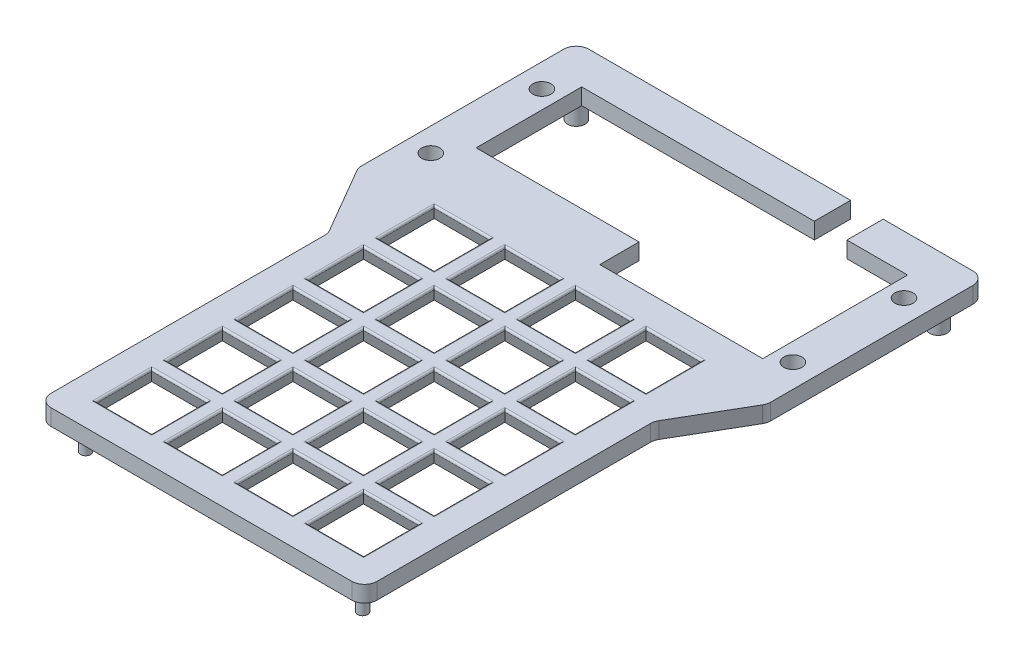
from build123d import *

# Parameters (mm, degrees)
BOSS_EXTRUDE1_DEPTH           = 4.5
SKETCH2_R                     = 1.4
SKETCH2_R_2                   = 2.4
BOSS_EXTRUDE2_DEPTH           = 7.5
SKETCH3_W                     = 45
SKETCH3_H                     = 10.839891038
SKETCH3_W_2                   = 9
SKETCH3_H_2                   = 10
SKETCH3_R                     = 2.5
CUT_EXTRUDE1_DEPTH            = 5
SKETCH4_W                     = 15
SKETCH4_H                     = 15
CUT_EXTRUDE2_DEPTH            = 4.5
CUT_EXTRUDE2_DRAFT            = -20
CUT_EXTRUDE2_PROFILE_2_DEPTH  = 4.5
CUT_EXTRUDE2_PROFILE_2_DRAFT  = -20
CUT_EXTRUDE2_PROFILE_3_DEPTH  = 4.5
CUT_EXTRUDE2_PROFILE_3_DRAFT  = -20
CUT_EXTRUDE2_PROFILE_4_DEPTH  = 4.5
CUT_EXTRUDE2_PROFILE_4_DRAFT  = -20
CUT_EXTRUDE2_PROFILE_5_DEPTH  = 4.5
CUT_EXTRUDE2_PROFILE_5_DRAFT  = -20
CUT_EXTRUDE2_PROFILE_6_DEPTH  = 4.5
CUT_EXTRUDE2_PROFILE_6_DRAFT  = -20
CUT_EXTRUDE2_PROFILE_7_DEPTH  = 4.5
CUT_EXTRUDE2_PROFILE_7_DRAFT  = -20
CUT_EXTRUDE2_PROFILE_8_DEPTH  = 4.5
CUT_EXTRUDE2_PROFILE_8_DRAFT  = -20
CUT_EXTRUDE2_PROFILE_9_DEPTH  = 4.5
CUT_EXTRUDE2_PROFILE_9_DRAFT  = -20
CUT_EXTRUDE2_PROFILE_10_DEPTH = 4.5
CUT_EXTRUDE2_PROFILE_10_DRAFT = -20
CUT_EXTRUDE2_PROFILE_11_DEPTH = 4.5
CUT_EXTRUDE2_PROFILE_11_DRAFT = -20
CUT_EXTRUDE2_PROFILE_12_DEPTH = 4.5
CUT_EXTRUDE2_PROFILE_12_DRAFT = -20
CUT_EXTRUDE2_PROFILE_13_DEPTH = 4.5
CUT_EXTRUDE2_PROFILE_13_DRAFT = -20
CUT_EXTRUDE2_PROFILE_14_DEPTH = 4.5
CUT_EXTRUDE2_PROFILE_14_DRAFT = -20
CUT_EXTRUDE2_PROFILE_15_DEPTH = 4.5
CUT_EXTRUDE2_PROFILE_15_DRAFT = -20
CUT_EXTRUDE2_PROFILE_16_DEPTH = 4.5
CUT_EXTRUDE2_PROFILE_16_DRAFT = -20
CUT_EXTRUDE2_PROFILE_17_DEPTH = 4.5
CUT_EXTRUDE2_PROFILE_17_DRAFT = -20
CUT_EXTRUDE2_PROFILE_18_DEPTH = 4.5
CUT_EXTRUDE2_PROFILE_18_DRAFT = -20
CUT_EXTRUDE2_PROFILE_19_DEPTH = 4.5
CUT_EXTRUDE2_PROFILE_19_DRAFT = -20
CUT_EXTRUDE2_PROFILE_20_DEPTH = 4.5
CUT_EXTRUDE2_PROFILE_20_DRAFT = -20
FILLET1_R                     = 3.5
FILLET3_R                     = 0.5


with BuildPart() as part:
    # Sketch1 → Boss-Extrude1 (new body)
    with BuildSketch(Plane(origin=(0, 0, 0), x_dir=(1, 0, 0), z_dir=(0, 1, 0))):
        Polygon((-57.597316241, 51.805869074), (-57.597316241, -8.444130926), (-46.097316241, -28.194130926), (-46.097316241, -108.194130926), (43.902683759, -108.194130926), (43.902683759, -28.194130926), (55.402683759, -8.444130926), (55.402683759, 51.805869074), align=None)
    extrude(amount=BOSS_EXTRUDE1_DEPTH)

    # Sketch2 → Boss-Extrude2 (add)
    with BuildSketch(Plane.XZ):
        with Locations(Location((-39.347316241, 101.944130926, 0), (0, 0, 90))):
            Circle(SKETCH2_R)
        with Locations(Location((37.152683759, 101.944130926, 0), (0, 0, 90))):
            Circle(SKETCH2_R)
        with Locations(Location((-51.097316241, -45.305869074, 0), (0, 0, 90))):
            Circle(SKETCH2_R_2)
        with Locations(Location((48.902683759, -45.305869074, 0), (0, 0, 90))):
            Circle(SKETCH2_R_2)
        with Locations(Location((-31.847316241, -5.130869074, 0), (0, 0, 90))):
            Circle(SKETCH2_R_2)
        with Locations(Location((-21.847316241, -5.130869074, 0), (0, 0, 90))):
            Circle(SKETCH2_R_2)
    extrude(amount=BOSS_EXTRUDE2_DEPTH)

    # Sketch3 → Cut-Extrude1 (cut)
    with BuildSketch(Plane.XZ):
        Polygon((-46.097316241, -41.805869074), (18.152683759, -41.805869074), (27.152683759, -41.805869074), (43.902683759, -41.805869074), (43.902683759, -12.645760112), (-1.097316241, -12.645760112), (-46.097316241, -12.645760112), align=None)
        with Locations((21.402683759, -7.225814593)):
            Rectangle(SKETCH3_W, SKETCH3_H)
        with Locations((22.652683759, -46.805869074)):
            Rectangle(SKETCH3_W_2, SKETCH3_H_2)
        with Locations(Location((48.902683759, -35.805869074, 0), (0, 0, 270))):
            Circle(SKETCH3_R)
        with Locations(Location((-51.097316241, -35.805869074, 0), (0, 0, 270))):
            Circle(SKETCH3_R)
        with Locations(Location((-51.097316241, -5.130869074, 0), (0, 0, 270))):
            Circle(SKETCH3_R)
        with Locations(Location((48.902683759, -5.130869074, 0), (0, 0, 270))):
            Circle(SKETCH3_R)
    extrude(amount=-CUT_EXTRUDE1_DEPTH, mode=Mode.SUBTRACT)


with BuildPart() as cut_extrude2_tool:
    # Sketch4 → Cut-Extrude2 (with draft: the straight prism first)
    with BuildSketch(Plane.XZ.offset(-4.5)):
        with Locations((-30.347316241, 92.694130926)):
            Rectangle(SKETCH4_W, SKETCH4_H)
    extrude(amount=CUT_EXTRUDE2_DEPTH)
    # Cut-Extrude2: the draft: its side faces are tilted about the plane it starts from
    cut_extrude2_sides = [cut_extrude2_tool.faces().sort_by_distance(p)[0] for p in [
        (-37.847316241, 2.25, 92.694130926),
        (-30.347316241, 2.25, 85.194130926),
        (-22.847316241, 2.25, 92.694130926),
        (-30.347316241, 2.25, 100.194130926),
    ]]
    draft(cut_extrude2_sides, Plane.XZ.offset(-4.5), CUT_EXTRUDE2_DRAFT)


with BuildPart() as part_1:
    add(part.part)

    # Cut-Extrude2: cut by cut_extrude2_tool
    add(cut_extrude2_tool.part, mode=Mode.SUBTRACT)


with BuildPart() as cut_extrude2_profile_2_tool:
    # Sketch4 → Cut-Extrude2 profile 2 (with draft: the straight prism first)
    with BuildSketch(Plane.XZ.offset(-4.5)):
        with Locations((-10.847316241, 92.694130926)):
            Rectangle(SKETCH4_W, SKETCH4_H)
    extrude(amount=CUT_EXTRUDE2_PROFILE_2_DEPTH)
    # Cut-Extrude2 profile 2: the draft: its side faces are tilted about the plane it starts from
    cut_extrude2_profile_2_sides = [cut_extrude2_profile_2_tool.faces().sort_by_distance(p)[0] for p in [
        (-10.847316241, 2.25, 85.194130926),
        (-3.347316241, 2.25, 92.694130926),
        (-10.847316241, 2.25, 100.194130926),
        (-18.347316241, 2.25, 92.694130926),
    ]]
    draft(cut_extrude2_profile_2_sides, Plane.XZ.offset(-4.5), CUT_EXTRUDE2_PROFILE_2_DRAFT)


with BuildPart() as part_2:
    add(part_1.part)

    # Cut-Extrude2 profile 2: cut by cut_extrude2_profile_2_tool
    add(cut_extrude2_profile_2_tool.part, mode=Mode.SUBTRACT)


with BuildPart() as cut_extrude2_profile_3_tool:
    # Sketch4 → Cut-Extrude2 profile 3 (with draft: the straight prism first)
    with BuildSketch(Plane.XZ.offset(-4.5)):
        with Locations((8.652683759, 92.694130926)):
            Rectangle(SKETCH4_W, SKETCH4_H)
    extrude(amount=CUT_EXTRUDE2_PROFILE_3_DEPTH)
    # Cut-Extrude2 profile 3: the draft: its side faces are tilted about the plane it starts from
    cut_extrude2_profile_3_sides = [cut_extrude2_profile_3_tool.faces().sort_by_distance(p)[0] for p in [
        (1.152683759, 2.25, 92.694130926),
        (8.652683759, 2.25, 85.194130926),
        (16.152683759, 2.25, 92.694130926),
        (8.652683759, 2.25, 100.194130926),
    ]]
    draft(cut_extrude2_profile_3_sides, Plane.XZ.offset(-4.5), CUT_EXTRUDE2_PROFILE_3_DRAFT)


with BuildPart() as part_3:
    add(part_2.part)

    # Cut-Extrude2 profile 3: cut by cut_extrude2_profile_3_tool
    add(cut_extrude2_profile_3_tool.part, mode=Mode.SUBTRACT)


with BuildPart() as cut_extrude2_profile_4_tool:
    # Sketch4 → Cut-Extrude2 profile 4 (with draft: the straight prism first)
    with BuildSketch(Plane.XZ.offset(-4.5)):
        with Locations((28.152683759, 92.694130926)):
            Rectangle(SKETCH4_W, SKETCH4_H)
    extrude(amount=CUT_EXTRUDE2_PROFILE_4_DEPTH)
    # Cut-Extrude2 profile 4: the draft: its side faces are tilted about the plane it starts from
    cut_extrude2_profile_4_sides = [cut_extrude2_profile_4_tool.faces().sort_by_distance(p)[0] for p in [
        (20.652683759, 2.25, 92.694130926),
        (28.152683759, 2.25, 85.194130926),
        (35.652683759, 2.25, 92.694130926),
        (28.152683759, 2.25, 100.194130926),
    ]]
    draft(cut_extrude2_profile_4_sides, Plane.XZ.offset(-4.5), CUT_EXTRUDE2_PROFILE_4_DRAFT)


with BuildPart() as part_4:
    add(part_3.part)

    # Cut-Extrude2 profile 4: cut by cut_extrude2_profile_4_tool
    add(cut_extrude2_profile_4_tool.part, mode=Mode.SUBTRACT)


with BuildPart() as cut_extrude2_profile_5_tool:
    # Sketch4 → Cut-Extrude2 profile 5 (with draft: the straight prism first)
    with BuildSketch(Plane.XZ.offset(-4.5)):
        with Locations((-10.847316241, 34.194130926)):
            Rectangle(SKETCH4_W, SKETCH4_H)
    extrude(amount=CUT_EXTRUDE2_PROFILE_5_DEPTH)
    # Cut-Extrude2 profile 5: the draft: its side faces are tilted about the plane it starts from
    cut_extrude2_profile_5_sides = [cut_extrude2_profile_5_tool.faces().sort_by_distance(p)[0] for p in [
        (-18.347316241, 2.25, 34.194130926),
        (-10.847316241, 2.25, 26.694130926),
        (-3.347316241, 2.25, 34.194130926),
        (-10.847316241, 2.25, 41.694130926),
    ]]
    draft(cut_extrude2_profile_5_sides, Plane.XZ.offset(-4.5), CUT_EXTRUDE2_PROFILE_5_DRAFT)


with BuildPart() as part_5:
    add(part_4.part)

    # Cut-Extrude2 profile 5: cut by cut_extrude2_profile_5_tool
    add(cut_extrude2_profile_5_tool.part, mode=Mode.SUBTRACT)


with BuildPart() as cut_extrude2_profile_6_tool:
    # Sketch4 → Cut-Extrude2 profile 6 (with draft: the straight prism first)
    with BuildSketch(Plane.XZ.offset(-4.5)):
        with Locations((-30.347316241, 73.194130926)):
            Rectangle(SKETCH4_W, SKETCH4_H)
    extrude(amount=CUT_EXTRUDE2_PROFILE_6_DEPTH)
    # Cut-Extrude2 profile 6: the draft: its side faces are tilted about the plane it starts from
    cut_extrude2_profile_6_sides = [cut_extrude2_profile_6_tool.faces().sort_by_distance(p)[0] for p in [
        (-37.847316241, 2.25, 73.194130926),
        (-30.347316241, 2.25, 65.694130926),
        (-22.847316241, 2.25, 73.194130926),
        (-30.347316241, 2.25, 80.694130926),
    ]]
    draft(cut_extrude2_profile_6_sides, Plane.XZ.offset(-4.5), CUT_EXTRUDE2_PROFILE_6_DRAFT)


with BuildPart() as part_6:
    add(part_5.part)

    # Cut-Extrude2 profile 6: cut by cut_extrude2_profile_6_tool
    add(cut_extrude2_profile_6_tool.part, mode=Mode.SUBTRACT)


with BuildPart() as cut_extrude2_profile_7_tool:
    # Sketch4 → Cut-Extrude2 profile 7 (with draft: the straight prism first)
    with BuildSketch(Plane.XZ.offset(-4.5)):
        with Locations((-10.847316241, 73.194130926)):
            Rectangle(SKETCH4_W, SKETCH4_H)
    extrude(amount=CUT_EXTRUDE2_PROFILE_7_DEPTH)
    # Cut-Extrude2 profile 7: the draft: its side faces are tilted about the plane it starts from
    cut_extrude2_profile_7_sides = [cut_extrude2_profile_7_tool.faces().sort_by_distance(p)[0] for p in [
        (-18.347316241, 2.25, 73.194130926),
        (-10.847316241, 2.25, 65.694130926),
        (-3.347316241, 2.25, 73.194130926),
        (-10.847316241, 2.25, 80.694130926),
    ]]
    draft(cut_extrude2_profile_7_sides, Plane.XZ.offset(-4.5), CUT_EXTRUDE2_PROFILE_7_DRAFT)


with BuildPart() as part_7:
    add(part_6.part)

    # Cut-Extrude2 profile 7: cut by cut_extrude2_profile_7_tool
    add(cut_extrude2_profile_7_tool.part, mode=Mode.SUBTRACT)


with BuildPart() as cut_extrude2_profile_8_tool:
    # Sketch4 → Cut-Extrude2 profile 8 (with draft: the straight prism first)
    with BuildSketch(Plane.XZ.offset(-4.5)):
        with Locations((8.652683759, 73.194130926)):
            Rectangle(SKETCH4_W, SKETCH4_H)
    extrude(amount=CUT_EXTRUDE2_PROFILE_8_DEPTH)
    # Cut-Extrude2 profile 8: the draft: its side faces are tilted about the plane it starts from
    cut_extrude2_profile_8_sides = [cut_extrude2_profile_8_tool.faces().sort_by_distance(p)[0] for p in [
        (1.152683759, 2.25, 73.194130926),
        (8.652683759, 2.25, 65.694130926),
        (16.152683759, 2.25, 73.194130926),
        (8.652683759, 2.25, 80.694130926),
    ]]
    draft(cut_extrude2_profile_8_sides, Plane.XZ.offset(-4.5), CUT_EXTRUDE2_PROFILE_8_DRAFT)


with BuildPart() as part_8:
    add(part_7.part)

    # Cut-Extrude2 profile 8: cut by cut_extrude2_profile_8_tool
    add(cut_extrude2_profile_8_tool.part, mode=Mode.SUBTRACT)


with BuildPart() as cut_extrude2_profile_9_tool:
    # Sketch4 → Cut-Extrude2 profile 9 (with draft: the straight prism first)
    with BuildSketch(Plane.XZ.offset(-4.5)):
        with Locations((28.152683759, 73.194130926)):
            Rectangle(SKETCH4_W, SKETCH4_H)
    extrude(amount=CUT_EXTRUDE2_PROFILE_9_DEPTH)
    # Cut-Extrude2 profile 9: the draft: its side faces are tilted about the plane it starts from
    cut_extrude2_profile_9_sides = [cut_extrude2_profile_9_tool.faces().sort_by_distance(p)[0] for p in [
        (20.652683759, 2.25, 73.194130926),
        (28.152683759, 2.25, 65.694130926),
        (35.652683759, 2.25, 73.194130926),
        (28.152683759, 2.25, 80.694130926),
    ]]
    draft(cut_extrude2_profile_9_sides, Plane.XZ.offset(-4.5), CUT_EXTRUDE2_PROFILE_9_DRAFT)


with BuildPart() as part_9:
    add(part_8.part)

    # Cut-Extrude2 profile 9: cut by cut_extrude2_profile_9_tool
    add(cut_extrude2_profile_9_tool.part, mode=Mode.SUBTRACT)


with BuildPart() as cut_extrude2_profile_10_tool:
    # Sketch4 → Cut-Extrude2 profile 10 (with draft: the straight prism first)
    with BuildSketch(Plane.XZ.offset(-4.5)):
        with Locations((-30.347316241, 53.694130926)):
            Rectangle(SKETCH4_W, SKETCH4_H)
    extrude(amount=CUT_EXTRUDE2_PROFILE_10_DEPTH)
    # Cut-Extrude2 profile 10: the draft: its side faces are tilted about the plane it starts from
    cut_extrude2_profile_10_sides = [cut_extrude2_profile_10_tool.faces().sort_by_distance(p)[0] for p in [
        (-37.847316241, 2.25, 53.694130926),
        (-30.347316241, 2.25, 46.194130926),
        (-22.847316241, 2.25, 53.694130926),
        (-30.347316241, 2.25, 61.194130926),
    ]]
    draft(cut_extrude2_profile_10_sides, Plane.XZ.offset(-4.5), CUT_EXTRUDE2_PROFILE_10_DRAFT)


with BuildPart() as part_10:
    add(part_9.part)

    # Cut-Extrude2 profile 10: cut by cut_extrude2_profile_10_tool
    add(cut_extrude2_profile_10_tool.part, mode=Mode.SUBTRACT)


with BuildPart() as cut_extrude2_profile_11_tool:
    # Sketch4 → Cut-Extrude2 profile 11 (with draft: the straight prism first)
    with BuildSketch(Plane.XZ.offset(-4.5)):
        with Locations((-10.847316241, 53.694130926)):
            Rectangle(SKETCH4_W, SKETCH4_H)
    extrude(amount=CUT_EXTRUDE2_PROFILE_11_DEPTH)
    # Cut-Extrude2 profile 11: the draft: its side faces are tilted about the plane it starts from
    cut_extrude2_profile_11_sides = [cut_extrude2_profile_11_tool.faces().sort_by_distance(p)[0] for p in [
        (-18.347316241, 2.25, 53.694130926),
        (-10.847316241, 2.25, 46.194130926),
        (-3.347316241, 2.25, 53.694130926),
        (-10.847316241, 2.25, 61.194130926),
    ]]
    draft(cut_extrude2_profile_11_sides, Plane.XZ.offset(-4.5), CUT_EXTRUDE2_PROFILE_11_DRAFT)


with BuildPart() as part_11:
    add(part_10.part)

    # Cut-Extrude2 profile 11: cut by cut_extrude2_profile_11_tool
    add(cut_extrude2_profile_11_tool.part, mode=Mode.SUBTRACT)


with BuildPart() as cut_extrude2_profile_12_tool:
    # Sketch4 → Cut-Extrude2 profile 12 (with draft: the straight prism first)
    with BuildSketch(Plane.XZ.offset(-4.5)):
        with Locations((8.652683759, 53.694130926)):
            Rectangle(SKETCH4_W, SKETCH4_H)
    extrude(amount=CUT_EXTRUDE2_PROFILE_12_DEPTH)
    # Cut-Extrude2 profile 12: the draft: its side faces are tilted about the plane it starts from
    cut_extrude2_profile_12_sides = [cut_extrude2_profile_12_tool.faces().sort_by_distance(p)[0] for p in [
        (1.152683759, 2.25, 53.694130926),
        (8.652683759, 2.25, 46.194130926),
        (16.152683759, 2.25, 53.694130926),
        (8.652683759, 2.25, 61.194130926),
    ]]
    draft(cut_extrude2_profile_12_sides, Plane.XZ.offset(-4.5), CUT_EXTRUDE2_PROFILE_12_DRAFT)


with BuildPart() as part_12:
    add(part_11.part)

    # Cut-Extrude2 profile 12: cut by cut_extrude2_profile_12_tool
    add(cut_extrude2_profile_12_tool.part, mode=Mode.SUBTRACT)


with BuildPart() as cut_extrude2_profile_13_tool:
    # Sketch4 → Cut-Extrude2 profile 13 (with draft: the straight prism first)
    with BuildSketch(Plane.XZ.offset(-4.5)):
        with Locations((28.152683759, 53.694130926)):
            Rectangle(SKETCH4_W, SKETCH4_H)
    extrude(amount=CUT_EXTRUDE2_PROFILE_13_DEPTH)
    # Cut-Extrude2 profile 13: the draft: its side faces are tilted about the plane it starts from
    cut_extrude2_profile_13_sides = [cut_extrude2_profile_13_tool.faces().sort_by_distance(p)[0] for p in [
        (20.652683759, 2.25, 53.694130926),
        (28.152683759, 2.25, 46.194130926),
        (35.652683759, 2.25, 53.694130926),
        (28.152683759, 2.25, 61.194130926),
    ]]
    draft(cut_extrude2_profile_13_sides, Plane.XZ.offset(-4.5), CUT_EXTRUDE2_PROFILE_13_DRAFT)


with BuildPart() as part_13:
    add(part_12.part)

    # Cut-Extrude2 profile 13: cut by cut_extrude2_profile_13_tool
    add(cut_extrude2_profile_13_tool.part, mode=Mode.SUBTRACT)


with BuildPart() as cut_extrude2_profile_14_tool:
    # Sketch4 → Cut-Extrude2 profile 14 (with draft: the straight prism first)
    with BuildSketch(Plane.XZ.offset(-4.5)):
        with Locations((-30.347316241, 34.194130926)):
            Rectangle(SKETCH4_W, SKETCH4_H)
    extrude(amount=CUT_EXTRUDE2_PROFILE_14_DEPTH)
    # Cut-Extrude2 profile 14: the draft: its side faces are tilted about the plane it starts from
    cut_extrude2_profile_14_sides = [cut_extrude2_profile_14_tool.faces().sort_by_distance(p)[0] for p in [
        (-37.847316241, 2.25, 34.194130926),
        (-30.347316241, 2.25, 26.694130926),
        (-22.847316241, 2.25, 34.194130926),
        (-30.347316241, 2.25, 41.694130926),
    ]]
    draft(cut_extrude2_profile_14_sides, Plane.XZ.offset(-4.5), CUT_EXTRUDE2_PROFILE_14_DRAFT)


with BuildPart() as part_14:
    add(part_13.part)

    # Cut-Extrude2 profile 14: cut by cut_extrude2_profile_14_tool
    add(cut_extrude2_profile_14_tool.part, mode=Mode.SUBTRACT)


with BuildPart() as cut_extrude2_profile_15_tool:
    # Sketch4 → Cut-Extrude2 profile 15 (with draft: the straight prism first)
    with BuildSketch(Plane.XZ.offset(-4.5)):
        with Locations((8.652683759, 34.194130926)):
            Rectangle(SKETCH4_W, SKETCH4_H)
    extrude(amount=CUT_EXTRUDE2_PROFILE_15_DEPTH)
    # Cut-Extrude2 profile 15: the draft: its side faces are tilted about the plane it starts from
    cut_extrude2_profile_15_sides = [cut_extrude2_profile_15_tool.faces().sort_by_distance(p)[0] for p in [
        (1.152683759, 2.25, 34.194130926),
        (8.652683759, 2.25, 26.694130926),
        (16.152683759, 2.25, 34.194130926),
        (8.652683759, 2.25, 41.694130926),
    ]]
    draft(cut_extrude2_profile_15_sides, Plane.XZ.offset(-4.5), CUT_EXTRUDE2_PROFILE_15_DRAFT)


with BuildPart() as part_15:
    add(part_14.part)

    # Cut-Extrude2 profile 15: cut by cut_extrude2_profile_15_tool
    add(cut_extrude2_profile_15_tool.part, mode=Mode.SUBTRACT)


with BuildPart() as cut_extrude2_profile_16_tool:
    # Sketch4 → Cut-Extrude2 profile 16 (with draft: the straight prism first)
    with BuildSketch(Plane.XZ.offset(-4.5)):
        with Locations((28.152683759, 34.194130926)):
            Rectangle(SKETCH4_W, SKETCH4_H)
    extrude(amount=CUT_EXTRUDE2_PROFILE_16_DEPTH)
    # Cut-Extrude2 profile 16: the draft: its side faces are tilted about the plane it starts from
    cut_extrude2_profile_16_sides = [cut_extrude2_profile_16_tool.faces().sort_by_distance(p)[0] for p in [
        (20.652683759, 2.25, 34.194130926),
        (28.152683759, 2.25, 26.694130926),
        (35.652683759, 2.25, 34.194130926),
        (28.152683759, 2.25, 41.694130926),
    ]]
    draft(cut_extrude2_profile_16_sides, Plane.XZ.offset(-4.5), CUT_EXTRUDE2_PROFILE_16_DRAFT)


with BuildPart() as part_16:
    add(part_15.part)

    # Cut-Extrude2 profile 16: cut by cut_extrude2_profile_16_tool
    add(cut_extrude2_profile_16_tool.part, mode=Mode.SUBTRACT)


with BuildPart() as cut_extrude2_profile_17_tool:
    # Sketch4 → Cut-Extrude2 profile 17 (with draft: the straight prism first)
    with BuildSketch(Plane.XZ.offset(-4.5)):
        with Locations((-30.347316241, 14.694130926)):
            Rectangle(SKETCH4_W, SKETCH4_H)
    extrude(amount=CUT_EXTRUDE2_PROFILE_17_DEPTH)
    # Cut-Extrude2 profile 17: the draft: its side faces are tilted about the plane it starts from
    cut_extrude2_profile_17_sides = [cut_extrude2_profile_17_tool.faces().sort_by_distance(p)[0] for p in [
        (-37.847316241, 2.25, 14.694130926),
        (-30.347316241, 2.25, 7.194130926),
        (-22.847316241, 2.25, 14.694130926),
        (-30.347316241, 2.25, 22.194130926),
    ]]
    draft(cut_extrude2_profile_17_sides, Plane.XZ.offset(-4.5), CUT_EXTRUDE2_PROFILE_17_DRAFT)


with BuildPart() as part_17:
    add(part_16.part)

    # Cut-Extrude2 profile 17: cut by cut_extrude2_profile_17_tool
    add(cut_extrude2_profile_17_tool.part, mode=Mode.SUBTRACT)


with BuildPart() as cut_extrude2_profile_18_tool:
    # Sketch4 → Cut-Extrude2 profile 18 (with draft: the straight prism first)
    with BuildSketch(Plane.XZ.offset(-4.5)):
        with Locations((-10.847316241, 14.694130926)):
            Rectangle(SKETCH4_W, SKETCH4_H)
    extrude(amount=CUT_EXTRUDE2_PROFILE_18_DEPTH)
    # Cut-Extrude2 profile 18: the draft: its side faces are tilted about the plane it starts from
    cut_extrude2_profile_18_sides = [cut_extrude2_profile_18_tool.faces().sort_by_distance(p)[0] for p in [
        (-18.347316241, 2.25, 14.694130926),
        (-10.847316241, 2.25, 7.194130926),
        (-3.347316241, 2.25, 14.694130926),
        (-10.847316241, 2.25, 22.194130926),
    ]]
    draft(cut_extrude2_profile_18_sides, Plane.XZ.offset(-4.5), CUT_EXTRUDE2_PROFILE_18_DRAFT)


with BuildPart() as part_18:
    add(part_17.part)

    # Cut-Extrude2 profile 18: cut by cut_extrude2_profile_18_tool
    add(cut_extrude2_profile_18_tool.part, mode=Mode.SUBTRACT)


with BuildPart() as cut_extrude2_profile_19_tool:
    # Sketch4 → Cut-Extrude2 profile 19 (with draft: the straight prism first)
    with BuildSketch(Plane.XZ.offset(-4.5)):
        with Locations((8.652683759, 14.694130926)):
            Rectangle(SKETCH4_W, SKETCH4_H)
    extrude(amount=CUT_EXTRUDE2_PROFILE_19_DEPTH)
    # Cut-Extrude2 profile 19: the draft: its side faces are tilted about the plane it starts from
    cut_extrude2_profile_19_sides = [cut_extrude2_profile_19_tool.faces().sort_by_distance(p)[0] for p in [
        (1.152683759, 2.25, 14.694130926),
        (8.652683759, 2.25, 7.194130926),
        (16.152683759, 2.25, 14.694130926),
        (8.652683759, 2.25, 22.194130926),
    ]]
    draft(cut_extrude2_profile_19_sides, Plane.XZ.offset(-4.5), CUT_EXTRUDE2_PROFILE_19_DRAFT)


with BuildPart() as part_19:
    add(part_18.part)

    # Cut-Extrude2 profile 19: cut by cut_extrude2_profile_19_tool
    add(cut_extrude2_profile_19_tool.part, mode=Mode.SUBTRACT)


with BuildPart() as cut_extrude2_profile_20_tool:
    # Sketch4 → Cut-Extrude2 profile 20 (with draft: the straight prism first)
    with BuildSketch(Plane.XZ.offset(-4.5)):
        with Locations((28.152683759, 14.694130926)):
            Rectangle(SKETCH4_W, SKETCH4_H)
    extrude(amount=CUT_EXTRUDE2_PROFILE_20_DEPTH)
    # Cut-Extrude2 profile 20: the draft: its side faces are tilted about the plane it starts from
    cut_extrude2_profile_20_sides = [cut_extrude2_profile_20_tool.faces().sort_by_distance(p)[0] for p in [
        (20.652683759, 2.25, 14.694130926),
        (28.152683759, 2.25, 7.194130926),
        (35.652683759, 2.25, 14.694130926),
        (28.152683759, 2.25, 22.194130926),
    ]]
    draft(cut_extrude2_profile_20_sides, Plane.XZ.offset(-4.5), CUT_EXTRUDE2_PROFILE_20_DRAFT)


with BuildPart() as part_20:
    add(part_19.part)

    # Cut-Extrude2 profile 20: cut by cut_extrude2_profile_20_tool
    add(cut_extrude2_profile_20_tool.part, mode=Mode.SUBTRACT)

    # Fillet1
    fillet1_edges = [part_20.edges().sort_by_distance(p)[0] for p in [
        (55.402683759, 2.25, 8.444130926),
        (43.902683759, 2.25, 28.194130926),
        (43.902683759, 2.25, 108.194130926),
        (-46.097316241, 2.25, 108.194130926),
        (-46.097316241, 2.25, 28.194130926),
        (-57.597316241, 2.25, 8.444130926),
        (-57.597316241, 2.25, -51.805869074),
        (55.402683759, 2.25, -51.805869074),
    ]]
    fillet(fillet1_edges, radius=FILLET1_R)

    # Fillet3
    fillet3_edges = [part_20.edges().sort_by_distance(p)[0] for p in [
        (-30.347316241, 4.5, 41.694130926),
        (-22.847316241, 4.5, 34.194130926),
        (-30.347316241, 4.5, 26.694130926),
        (-37.847316241, 4.5, 34.194130926),
        (28.152683759, 4.5, 61.194130926),
        (35.652683759, 4.5, 53.694130926),
        (28.152683759, 4.5, 46.194130926),
        (20.652683759, 4.5, 53.694130926),
        (8.652683759, 4.5, 61.194130926),
        (16.152683759, 4.5, 53.694130926),
        (8.652683759, 4.5, 46.194130926),
        (1.152683759, 4.5, 53.694130926),
        (-10.847316241, 4.5, 61.194130926),
        (-3.347316241, 4.5, 53.694130926),
        (-10.847316241, 4.5, 46.194130926),
        (-18.347316241, 4.5, 53.694130926),
        (-30.347316241, 4.5, 22.194130926),
        (-22.847316241, 4.5, 14.694130926),
        (-30.347316241, 4.5, 7.194130926),
        (-37.847316241, 4.5, 14.694130926),
        (28.152683759, 4.5, 41.694130926),
        (35.652683759, 4.5, 34.194130926),
        (28.152683759, 4.5, 26.694130926),
        (20.652683759, 4.5, 34.194130926),
        (8.652683759, 4.5, 41.694130926),
        (16.152683759, 4.5, 34.194130926),
        (8.652683759, 4.5, 26.694130926),
        (1.152683759, 4.5, 34.194130926),
        (-10.847316241, 4.5, 41.694130926),
        (-3.347316241, 4.5, 34.194130926),
        (-10.847316241, 4.5, 26.694130926),
        (-18.347316241, 4.5, 34.194130926),
        (-10.847316241, 4.5, 80.694130926),
        (-3.347316241, 4.5, 73.194130926),
        (-10.847316241, 4.5, 65.694130926),
        (-18.347316241, 4.5, 73.194130926),
        (28.152683759, 4.5, 100.194130926),
        (35.652683759, 4.5, 92.694130926),
        (28.152683759, 4.5, 85.194130926),
        (20.652683759, 4.5, 92.694130926),
        (8.652683759, 4.5, 100.194130926),
        (16.152683759, 4.5, 92.694130926),
        (8.652683759, 4.5, 85.194130926),
        (1.152683759, 4.5, 92.694130926),
        (-10.847316241, 4.5, 100.194130926),
        (-3.347316241, 4.5, 92.694130926),
        (-10.847316241, 4.5, 85.194130926),
        (-18.347316241, 4.5, 92.694130926),
        (-30.347316241, 4.5, 61.194130926),
        (-22.847316241, 4.5, 53.694130926),
        (-30.347316241, 4.5, 46.194130926),
        (-37.847316241, 4.5, 53.694130926),
        (28.152683759, 4.5, 80.694130926),
        (35.652683759, 4.5, 73.194130926),
        (28.152683759, 4.5, 65.694130926),
        (20.652683759, 4.5, 73.194130926),
        (8.652683759, 4.5, 80.694130926),
        (16.152683759, 4.5, 73.194130926),
        (8.652683759, 4.5, 65.694130926),
        (1.152683759, 4.5, 73.194130926),
        (-30.347316241, 4.5, 80.694130926),
        (-22.847316241, 4.5, 73.194130926),
        (-30.347316241, 4.5, 65.694130926),
        (-37.847316241, 4.5, 73.194130926),
        (-10.847316241, 4.5, 22.194130926),
        (-3.347316241, 4.5, 14.694130926),
        (-10.847316241, 4.5, 7.194130926),
        (-18.347316241, 4.5, 14.694130926),
        (8.652683759, 4.5, 22.194130926),
        (16.152683759, 4.5, 14.694130926),
        (8.652683759, 4.5, 7.194130926),
        (1.152683759, 4.5, 14.694130926),
        (28.152683759, 4.5, 22.194130926),
        (35.652683759, 4.5, 14.694130926),
        (28.152683759, 4.5, 7.194130926),
        (20.652683759, 4.5, 14.694130926),
        (-30.347316241, 4.5, 100.194130926),
        (-22.847316241, 4.5, 92.694130926),
        (-30.347316241, 4.5, 85.194130926),
        (-37.847316241, 4.5, 92.694130926),
    ]]
    fillet(fillet3_edges, radius=FILLET3_R)


solid = part_20.part
